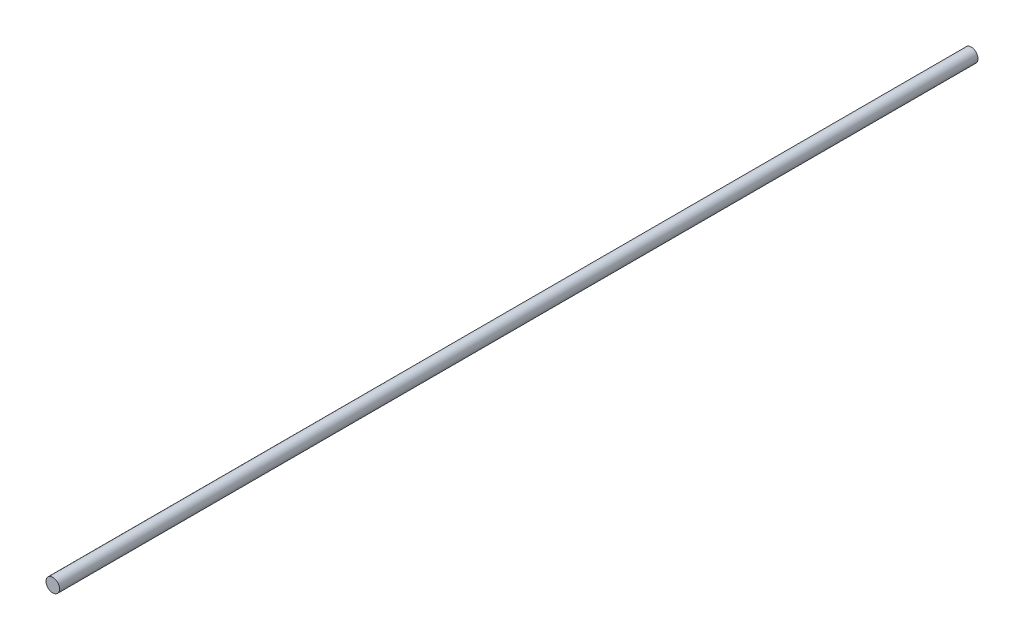
from build123d import *

# Parameters (mm, degrees)
CROQUIS1_R              = 4.3
SALIENTE_EXTRUIR1_DEPTH = 583


with BuildPart() as part:
    # Croquis1 → Saliente-Extruir1 (new body)
    with BuildSketch(Plane.XY):
        with Locations((-7.140185635, 7.661040453)):
            Circle(CROQUIS1_R)
    extrude(amount=SALIENTE_EXTRUIR1_DEPTH)


solid = part.part
